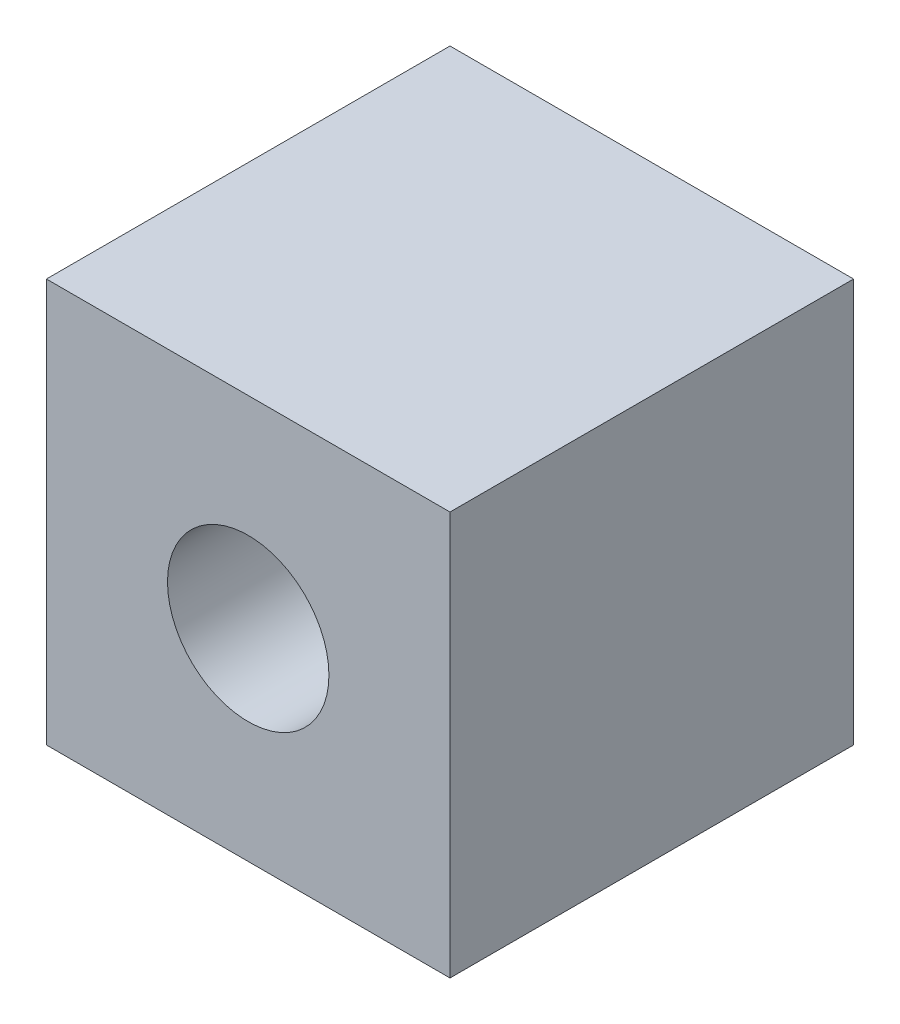
from build123d import *

# Parameters (mm, degrees)
SKETCH_1_W          = 5
SKETCH_1_H          = 5
EXTRUDE_1_DEPTH     = 5
SKETCH_3_R          = 1
CUT_EXTRUDE_1_DEPTH = 5


with BuildPart() as part:
    # 草图1 → 凸台-拉伸1 (new body)
    with BuildSketch(Plane.XY):
        with Locations((2.5, 2.5)):
            Rectangle(SKETCH_1_W, SKETCH_1_H)
    extrude(amount=-EXTRUDE_1_DEPTH)

    # 草图3 → 切除-拉伸1 (cut)
    with BuildSketch(Plane.XY):
        with Locations((2.5, 2.5)):
            Circle(SKETCH_3_R)
    extrude(amount=-CUT_EXTRUDE_1_DEPTH, mode=Mode.SUBTRACT)


solid = part.part
